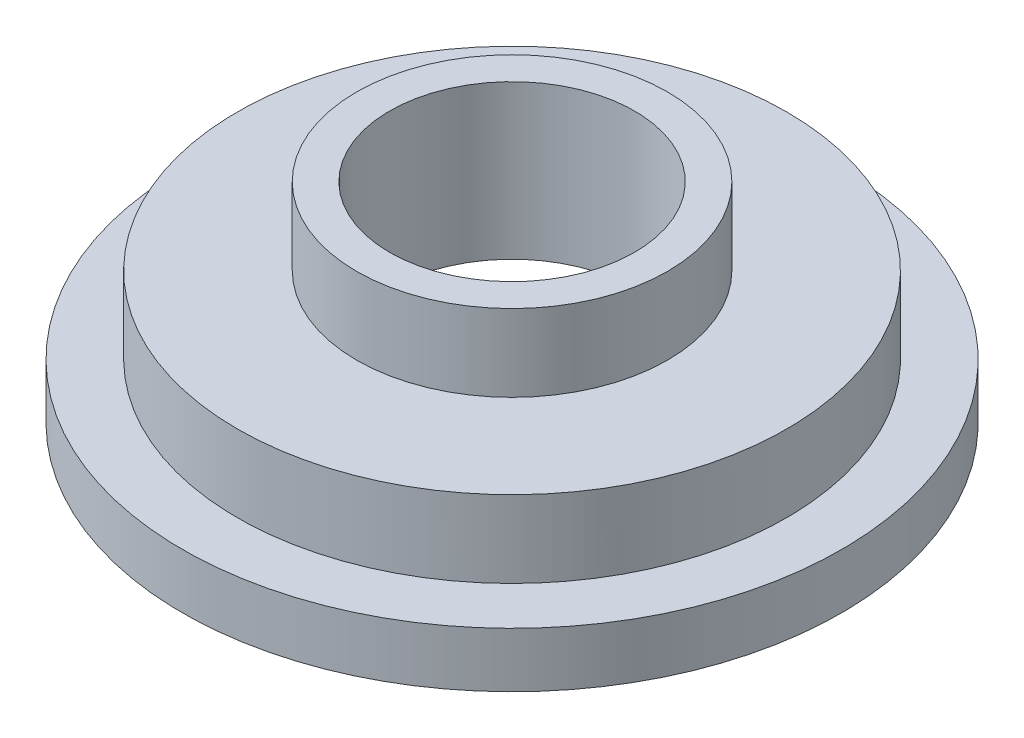
from build123d import *

# Parameters (mm, degrees)
SKETCH1_R           = 25
SKETCH1_R_2         = 11.15
BOSS_EXTRUDE1_DEPTH = 7
SKETCH2_R           = 14.15
SKETCH2_R_2         = 11.15
BOSS_EXTRUDE2_DEPTH = 7
SKETCH3_R           = 30
SKETCH3_R_2         = 20
BOSS_EXTRUDE3_DEPTH = 5


with BuildPart() as part:
    # Sketch1 → Boss-Extrude1 (new body)
    with BuildSketch(Plane(origin=(0, 0, 0), x_dir=(1, 0, 0), z_dir=(0, 1, 0))):
        with Locations(Location((0, 0, 0), (0, 0, 270))):
            Circle(SKETCH1_R)
        with Locations(Location((0, 0, 0), (0, 0, 270))):
            Circle(SKETCH1_R_2, mode=Mode.SUBTRACT)
    extrude(amount=BOSS_EXTRUDE1_DEPTH)

    # Sketch2 → Boss-Extrude2 (add)
    with BuildSketch(Plane(origin=(0, 7, 0), x_dir=(1, 0, 0), z_dir=(0, 1, 0))):
        with Locations(Location((0, 0, 0), (0, 0, 270))):
            Circle(SKETCH2_R)
        with Locations(Location((0, 0, 0), (0, 0, 270))):
            Circle(SKETCH2_R_2, mode=Mode.SUBTRACT)
    extrude(amount=BOSS_EXTRUDE2_DEPTH)

    # Sketch3 → Boss-Extrude3 (add)
    with BuildSketch(Plane.XZ):
        with Locations(Location((0, 0, 0), (0, 0, 270))):
            Circle(SKETCH3_R)
        with Locations(Location((0, 0, 0), (0, 0, 270))):
            Circle(SKETCH3_R_2, mode=Mode.SUBTRACT)
    extrude(amount=BOSS_EXTRUDE3_DEPTH)


solid = part.part
